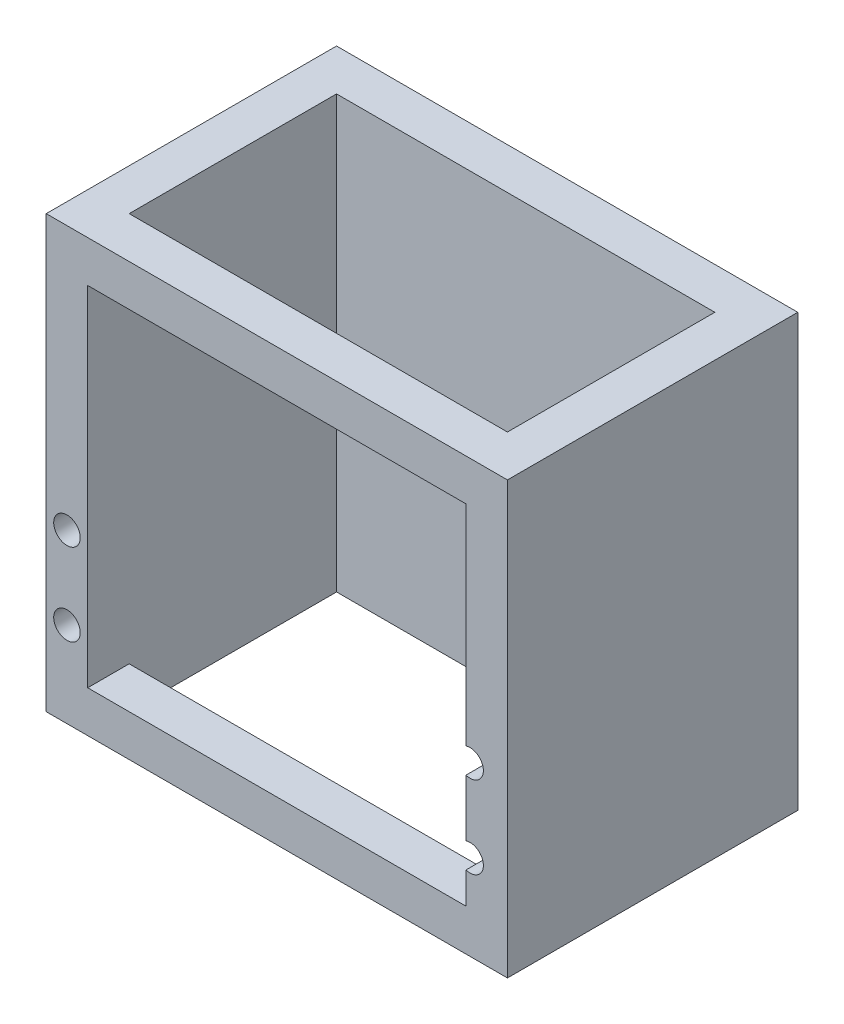
from build123d import *

# Parameters (mm, degrees)
SKETCH1_W           = 55.6
SKETCH1_H           = 35
SKETCH1_W_2         = 45.6
SKETCH1_H_2         = 25
BOSS_EXTRUDE1_DEPTH = 52
SKETCH2_W           = 45.6
SKETCH2_H           = 42
CUT_EXTRUDE1_DEPTH  = 5
SKETCH3_R           = 1.6
SKETCH3_W           = 40
SKETCH3_H           = 20.5
CUT_EXTRUDE2_DEPTH  = 5


with BuildPart() as part:
    # Sketch1 → Boss-Extrude1 (new body)
    with BuildSketch(Plane(origin=(0, 0, 0), x_dir=(1, 0, 0), z_dir=(0, 1, 0))):
        with Locations((27.8, -17.5)):
            Rectangle(SKETCH1_W, SKETCH1_H)
        with Locations((27.8, -17.5)):
            Rectangle(SKETCH1_W_2, SKETCH1_H_2, mode=Mode.SUBTRACT)
    extrude(amount=BOSS_EXTRUDE1_DEPTH)

    # Sketch2 → Cut-Extrude1 (cut)
    with BuildSketch(Plane.XY.offset(35)):
        with Locations((27.8, 26)):
            Rectangle(SKETCH2_W, SKETCH2_H)
    extrude(amount=-CUT_EXTRUDE1_DEPTH, mode=Mode.SUBTRACT)

    # Sketch3 → Cut-Extrude2 (cut)
    with BuildSketch(Plane.XY.offset(35)):
        with Locations((51.1, 20.2)):
            Circle(SKETCH3_R)
        with Locations((51.1, 10.3)):
            Circle(SKETCH3_R)
        with Locations((2.5, 10.3)):
            Circle(SKETCH3_R)
        with Locations((2.5, 20.2)):
            Circle(SKETCH3_R)
        with Locations((26.8, 15.25)):
            Rectangle(SKETCH3_W, SKETCH3_H)
    extrude(amount=-CUT_EXTRUDE2_DEPTH, mode=Mode.SUBTRACT)


solid = part.part
